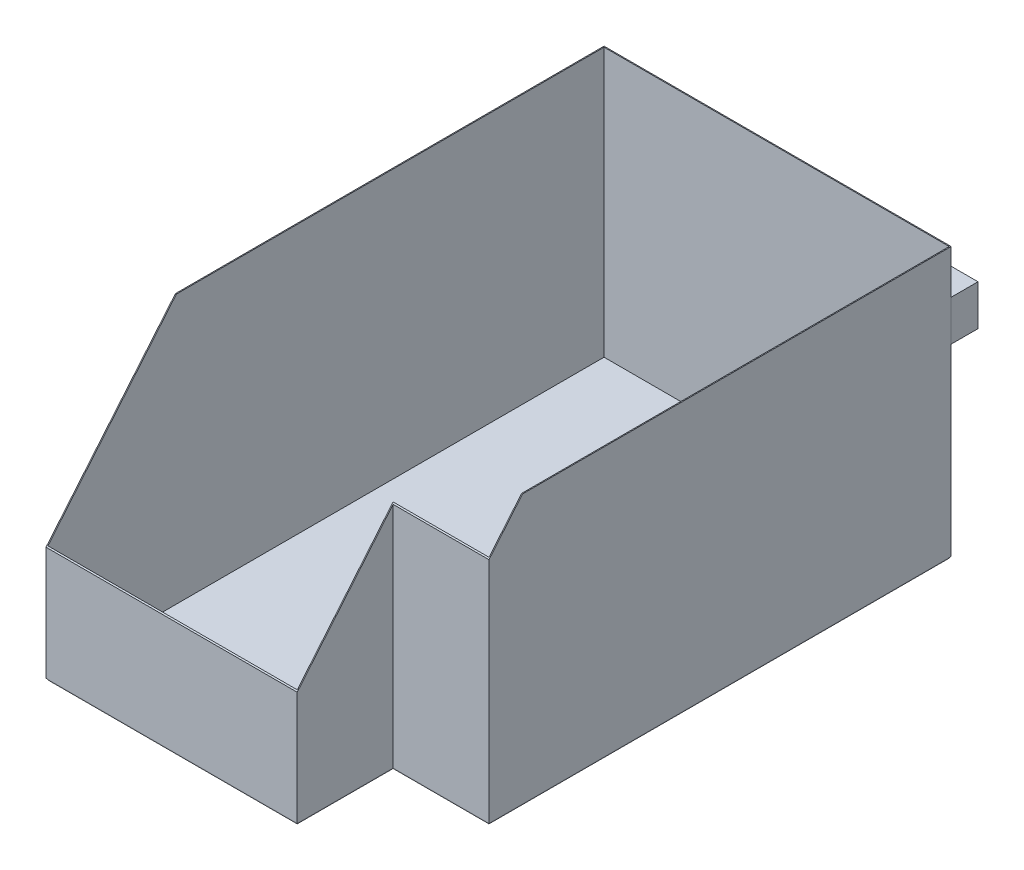
from build123d import *

# Parameters (mm, degrees)
BOSS_EXTRUDE1_DEPTH     = 1.5
BOSS_EXTRUDE2_DEPTH     = 280
SKETCH4_W               = 360
SKETCH4_H               = 42.385541564
BOSS_EXTRUDE3_DEPTH     = 30
CUT_EXTRUDE1_DEPTH      = 585.344407265
CUT_EXTRUDE1_DEPTH_BACK = 585.344407265


with BuildPart() as part:
    # Sketch1 → Boss-Extrude1 (new body)
    with BuildSketch(Plane(origin=(0, 0, 0), x_dir=(1, 0, 0), z_dir=(0, 1, 0))):
        Polygon((-82.151383235, 217.826300096), (277.848616765, 217.826300096), (277.848616765, -262.173699904), (177.848616765, -262.173699904), (177.848616765, -362.173699904), (-82.151383235, -362.173699904), align=None)
    extrude(amount=BOSS_EXTRUDE1_DEPTH)


with BuildPart() as body_2:
    # Sketch2 → Boss-Extrude2 (new body)
    with BuildSketch(Plane(origin=(0, 1.5, 0), x_dir=(1, 0, 0), z_dir=(0, 1, 0))):
        Polygon((-83.151383235, -363.173699904), (178.848616765, -363.173699904), (178.848616765, -263.173699904), (278.848616765, -263.173699904), (278.848616765, 218.826300096), (-83.151383235, 218.826300096), align=None)
        Polygon((-82.151383235, 217.826300096), (-82.151383235, -362.173699904), (177.848616765, -362.173699904), (177.848616765, -262.173699904), (277.848616765, -262.173699904), (277.848616765, 217.826300096), align=None, mode=Mode.SUBTRACT)
    extrude(amount=BOSS_EXTRUDE2_DEPTH)

    # Sketch3 → Cut-Extrude1 (cut, two sides: drawn at the far end of the back side and taken through both)
    with BuildSketch(Plane.ZY.offset(82.151383235).offset(-CUT_EXTRUDE1_DEPTH_BACK)):
        Polygon((363.173699904, 119.920481981), (228.195222706, 281.5), (363.173699904, 281.5), align=None)
    extrude(amount=CUT_EXTRUDE1_DEPTH + CUT_EXTRUDE1_DEPTH_BACK, mode=Mode.SUBTRACT)


with BuildPart() as body_3:
    # Sketch4 → Boss-Extrude3 (new body)
    with BuildSketch(Plane(origin=(0, 0, -217.826300096), x_dir=(-1, 0, 0), z_dir=(0, 0, -1))):
        with Locations((-97.848616765, 213.483316708)):
            Rectangle(SKETCH4_W, SKETCH4_H)
    extrude(amount=BOSS_EXTRUDE3_DEPTH)


solid = Compound([part.part, body_2.part, body_3.part])
